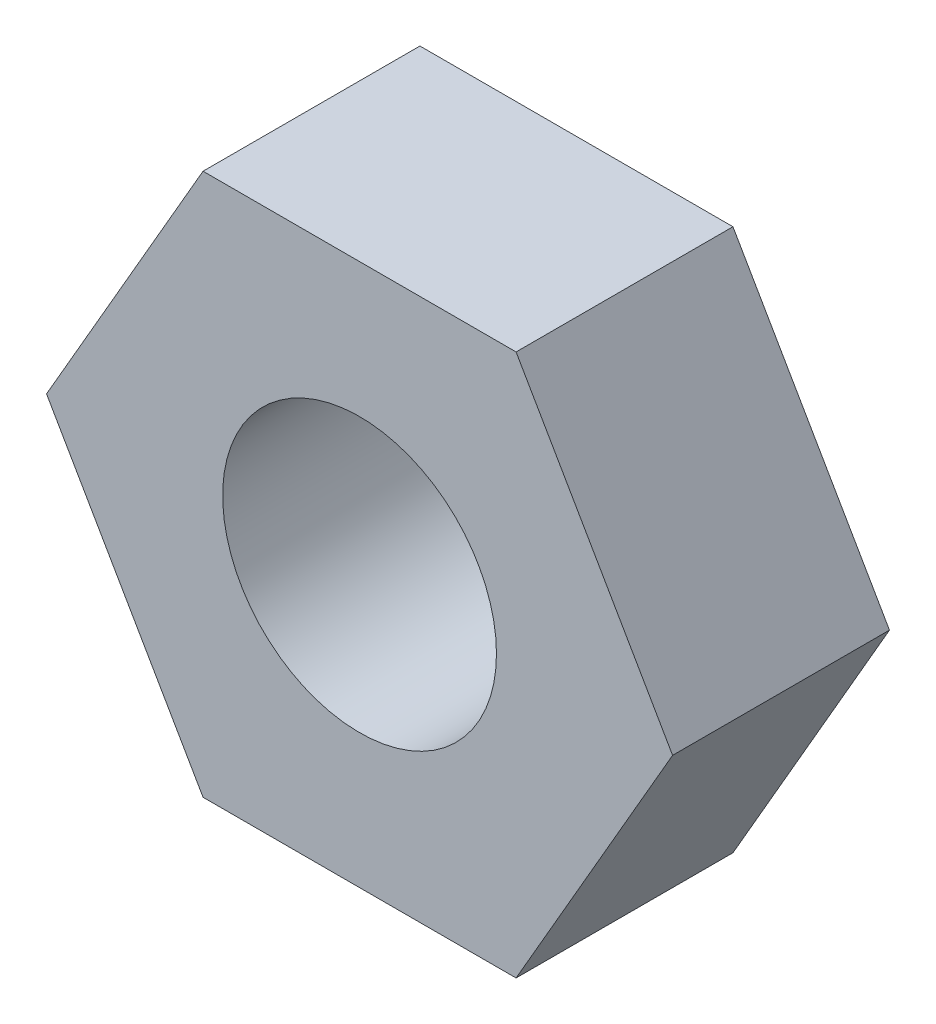
from build123d import *

# Parameters (mm, degrees)
ISO4032_M2_AF4_H1P6_SKETCH_R = 1.01
ISO4032_M2_AF4_H1P6_DEPTH    = 1.6


with BuildPart() as part:
    # ISO4032_M2_AF4_h1p6_Sketch → ISO4032_M2_AF4_h1p6 (new body)
    with BuildSketch(Plane.XY):
        Polygon((2.309401077, 0), (1.154700538, 2), (-1.154700538, 2), (-2.309401077, 0), (-1.154700538, -2), (1.154700538, -2), align=None)
        Circle(ISO4032_M2_AF4_H1P6_SKETCH_R, mode=Mode.SUBTRACT)
    extrude(amount=ISO4032_M2_AF4_H1P6_DEPTH)


solid = part.part
